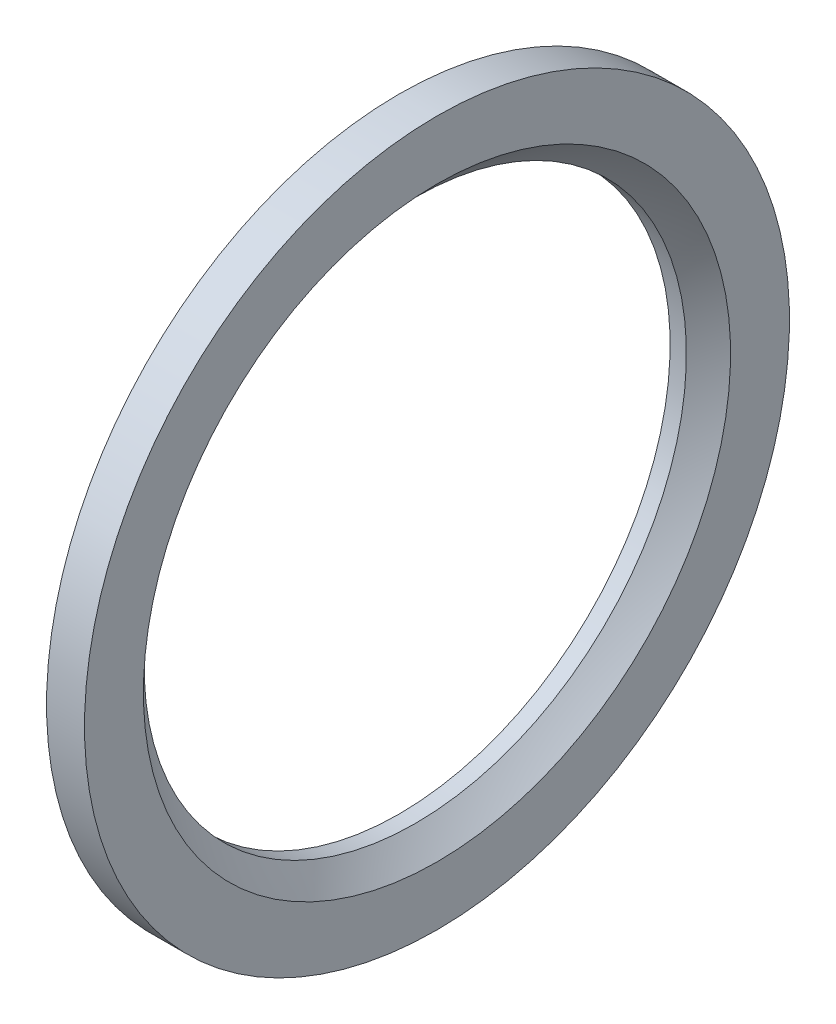
from build123d import *


with BuildPart() as part:
    # Sketch1 → Revolve1 (revolve)
    with BuildSketch(Plane.XY, mode=Mode.PRIVATE) as revolve1_sk:
        with BuildLine():
            Line((0.381, 6.35), (0, 6.35))
            Line((0, 6.35), (0, 8.255))
            Line((0, 8.255), (0.889, 8.255))
            Line((0.889, 8.255), (0.889, 6.875866788))
            ThreePointArc((0.889, 6.875866788), (0.62995228, 6.617809613), (0.381, 6.35))
        make_face()
    revolve(revolve1_sk.sketch.rotate(Axis((0, 0, 0), (1, 0, 0)), 180), axis=Axis((0, 0, 0), (1, 0, 0)))


solid = part.part
